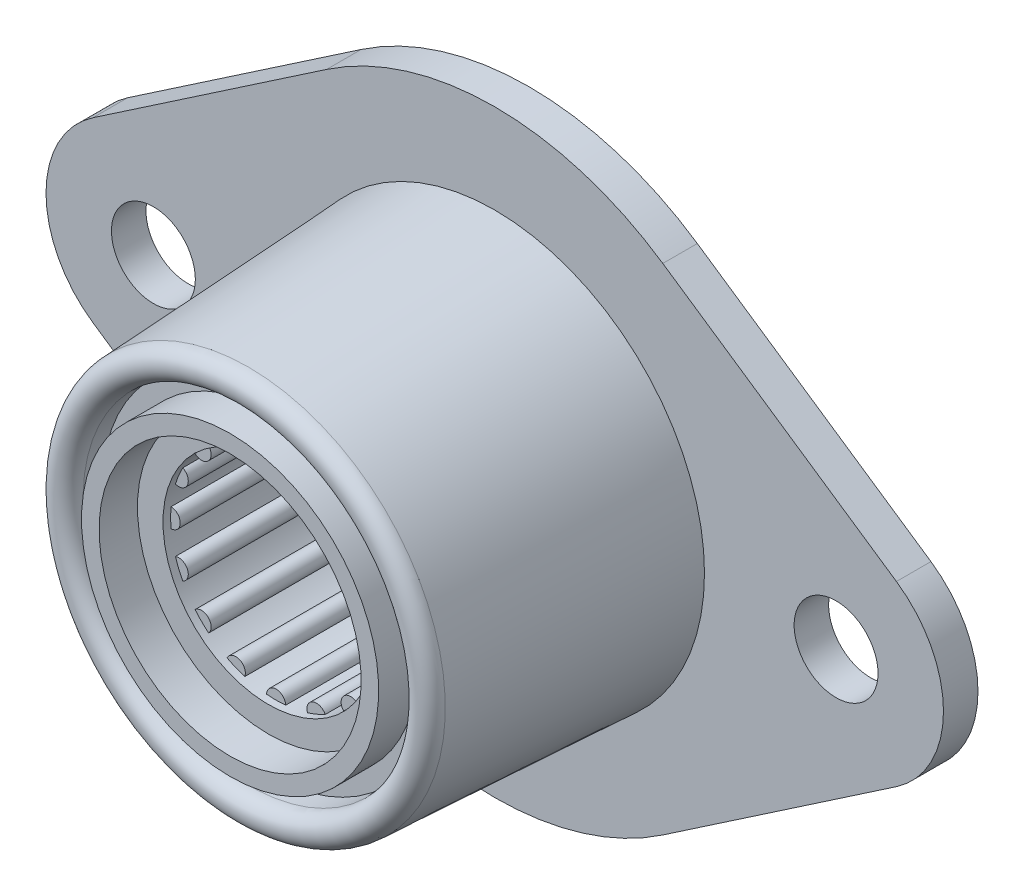
from build123d import *
from build123d.topology import SkipClean

# Parameters (mm, degrees)
SKETCH1_R          = 2.778125
SKETCH1_R_2        = 13.890625
EXTRUDE1_DEPTH     = 2.286
CUT_EXTRUDE2_DEPTH = 40.673325883
SKETCH4_R          = 6.985
CUT_EXTRUDE3_DEPTH = 0.508
CUT_EXTRUDE4_START = -0.508
SKETCH5_R          = 6.985
CUT_EXTRUDE4_DEPTH = 0.508


with BuildPart() as part:
    # Sketch1 → Extrude1 (new body)
    with BuildSketch(Plane.XY):
        with BuildLine():
            Line((-26.601505618, 5.883577046), (-11.130337079, 16.389964628))
            ThreePointArc((-11.130337079, 16.389964628), (0, 19.812), (11.130337079, 16.389964628))
            Line((11.130337079, 16.389964628), (26.601505618, 5.883577046))
            ThreePointArc((26.601505618, 5.883577046), (29.718, 0), (26.601505618, -5.883577046))
            Line((26.601505618, -5.883577046), (11.130337079, -16.389964628))
            ThreePointArc((11.130337079, -16.389964628), (0, -19.812), (-11.130337079, -16.389964628))
            Line((-11.130337079, -16.389964628), (-26.601505618, -5.883577046))
            ThreePointArc((-26.601505618, -5.883577046), (-29.718, 0), (-26.601505618, 5.883577046))
        make_face()
        with Locations((-22.606, 0)):
            Circle(SKETCH1_R, mode=Mode.SUBTRACT)
        with Locations((22.606, 0)):
            Circle(SKETCH1_R, mode=Mode.SUBTRACT)
        Circle(SKETCH1_R_2, mode=Mode.SUBTRACT)
    extrude(amount=EXTRUDE1_DEPTH)

    # Sketch2 → Revolve1 (revolve)
    with BuildSketch(Plane(origin=(0, 0, 0), x_dir=(0, 0, -1), z_dir=(1, 0, 0))):
        with BuildLine():
            Line((0, 13.890625), (-2.286, 13.890625))
            Line((-2.286, 13.890625), (-18.594513119, 13.035932044))
            ThreePointArc((-18.594513119, 13.035932044), (-19.278789036, 12.720476525), (-19.558, 12.020628718))
            ThreePointArc((-19.558, 12.020628718), (-19.260216439, 11.301715605), (-18.541303326, 11.003932044))
            Line((-18.541303326, 11.003932044), (-17.271303326, 11.003932044))
            Line((-17.271303326, 11.003932044), (-17.271303326, 9.840449033))
            Line((-17.271303326, 9.840449033), (-19.812, 9.840449033))
            Line((-19.812, 9.840449033), (-19.812, 8.676966022))
            Line((-19.812, 8.676966022), (-17.271303326, 8.676966022))
            Line((-17.271303326, 8.676966022), (-17.271303326, 7.513483011))
            Line((-17.271303326, 7.513483011), (-17.271303326, 6.35))
            Line((-17.271303326, 6.35), (0, 6.35))
            Line((0, 6.35), (0, 13.890625))
        make_face()
    revolve(axis=Axis((0, 0, 0), (0, 0, 1)))

    # Sketch3 → Cut-Extrude2 (cut, through all)
    with BuildSketch(Plane.XY.offset(17.271303326)):
        with BuildLine():
            ThreePointArc((-3.248055272, 6.183879199), (-3.880658078, 5.807815242), (-4.470182484, 5.367279904))
            ThreePointArc((-4.470182484, 5.367279904), (-4.490128061, 4.490128061), (-5.367279904, 4.470182484))
            ThreePointArc((-5.367279904, 4.470182484), (-5.807815242, 3.880658078), (-6.183879199, 3.248055272))
            ThreePointArc((-6.183879199, 3.248055272), (-5.866635031, 2.430039796), (-6.669384824, 2.075941007))
            ThreePointArc((-6.669384824, 2.075941007), (-6.850785184, 1.362705899), (-6.956136364, 0.634343669))
            ThreePointArc((-6.956136364, 0.634343669), (-6.35, 0), (-6.956136364, -0.634343669))
            ThreePointArc((-6.956136364, -0.634343669), (-6.850785184, -1.362705899), (-6.669384824, -2.075941007))
            ThreePointArc((-6.669384824, -2.075941007), (-5.866635031, -2.430039796), (-6.183879199, -3.248055272))
            ThreePointArc((-6.183879199, -3.248055272), (-5.807815242, -3.880658078), (-5.367279904, -4.470182484))
            ThreePointArc((-5.367279904, -4.470182484), (-4.490128061, -4.490128061), (-4.470182484, -5.367279904))
            ThreePointArc((-4.470182484, -5.367279904), (-3.880658078, -5.807815242), (-3.248055272, -6.183879199))
            ThreePointArc((-3.248055272, -6.183879199), (-2.430039796, -5.866635031), (-2.075941007, -6.669384824))
            ThreePointArc((-2.075941007, -6.669384824), (-1.362705899, -6.850785184), (-0.634343669, -6.956136364))
            ThreePointArc((-0.634343669, -6.956136364), (0, -6.35), (0.634343669, -6.956136364))
            ThreePointArc((0.634343669, -6.956136364), (1.362705899, -6.850785184), (2.075941007, -6.669384824))
            ThreePointArc((2.075941007, -6.669384824), (2.430039796, -5.866635031), (3.248055272, -6.183879199))
            ThreePointArc((3.248055272, -6.183879199), (3.880658078, -5.807815242), (4.470182484, -5.367279904))
            ThreePointArc((4.470182484, -5.367279904), (4.490128061, -4.490128061), (5.367279904, -4.470182484))
            ThreePointArc((5.367279904, -4.470182484), (5.807815242, -3.880658078), (6.183879199, -3.248055272))
            ThreePointArc((6.183879199, -3.248055272), (5.866635031, -2.430039796), (6.669384824, -2.075941007))
            ThreePointArc((6.669384824, -2.075941007), (6.850785184, -1.362705899), (6.956136364, -0.634343669))
            ThreePointArc((6.956136364, -0.634343669), (6.35, 0), (6.956136364, 0.634343669))
            ThreePointArc((6.956136364, 0.634343669), (6.850785184, 1.362705899), (6.669384824, 2.075941007))
            ThreePointArc((6.669384824, 2.075941007), (5.866635031, 2.430039796), (6.183879199, 3.248055272))
            ThreePointArc((6.183879199, 3.248055272), (5.807815242, 3.880658078), (5.367279904, 4.470182484))
            ThreePointArc((5.367279904, 4.470182484), (4.490128061, 4.490128061), (4.470182484, 5.367279904))
            ThreePointArc((4.470182484, 5.367279904), (3.880658078, 5.807815242), (3.248055272, 6.183879199))
            ThreePointArc((3.248055272, 6.183879199), (2.430039796, 5.866635031), (2.075941007, 6.669384824))
            ThreePointArc((2.075941007, 6.669384824), (1.362705899, 6.850785184), (0.634343669, 6.956136364))
            ThreePointArc((0.634343669, 6.956136364), (0, 6.35), (-0.634343669, 6.956136364))
            ThreePointArc((-0.634343669, 6.956136364), (-1.362705899, 6.850785184), (-2.075941007, 6.669384824))
            ThreePointArc((-2.075941007, 6.669384824), (-2.430039796, 5.866635031), (-3.248055272, 6.183879199))
        make_face()
    extrude(amount=-CUT_EXTRUDE2_DEPTH, mode=Mode.SUBTRACT)

    # Sketch4 → Cut-Extrude3 (cut)
    with BuildSketch(Plane.XY.offset(17.271303326)):
        Circle(SKETCH4_R)
    extrude(amount=-CUT_EXTRUDE3_DEPTH, mode=Mode.SUBTRACT)

    # Sketch5 → Cut-Extrude4 (cut)
    with SkipClean():  # the faces are left unmerged after this step: merging them gives an invalid solid
        with BuildSketch(Plane(origin=(0, 0, 0), x_dir=(-1, 0, 0), z_dir=(0, 0, -1)).offset(CUT_EXTRUDE4_START)):
            with Locations(Location((0, 0, 0), (0, 0, 180))):
                Circle(SKETCH5_R)
        extrude(amount=CUT_EXTRUDE4_DEPTH, mode=Mode.SUBTRACT)


solid = part.part
